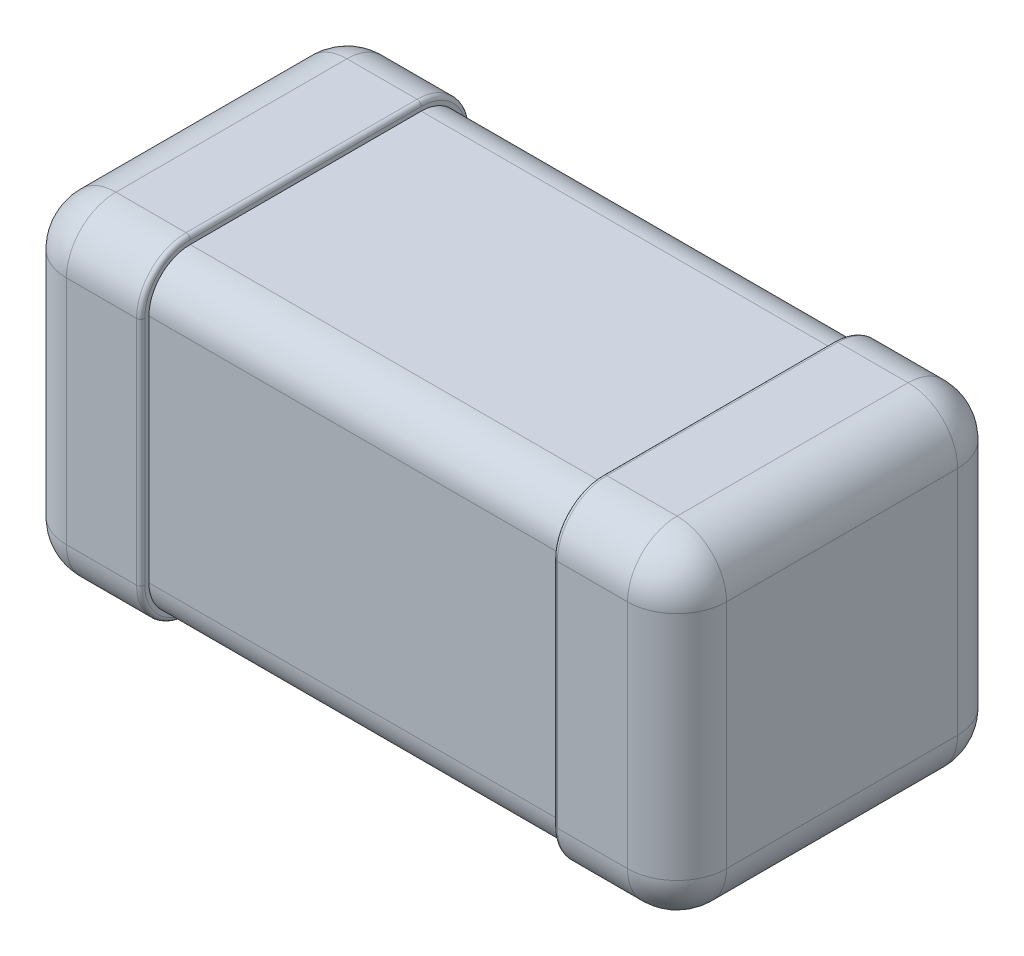
from build123d import *

# Parameters (mm, degrees)
SKETCH1_W               = 3.2
SKETCH1_H               = 1.6
BOSS_EXTRUDE1_DEPTH     = 0.8
CUT_EXTRUDE1_DEPTH      = 1
CUT_EXTRUDE1_DEPTH_BACK = 1
SKETCH3_OUTSIDE_W       = 4.384
SKETCH3_OUTSIDE_H       = 4.384
SKETCH3_OUTSIDE_W_2     = 1.52
SKETCH3_OUTSIDE_H_2     = 1.52
FILLET1_R               = 0.2
FILLET2_R               = 0.24
FILLET3_R               = 0.02


with BuildPart() as part:
    # Sketch1 → Boss-Extrude1 (new, symmetric)
    with BuildSketch(Plane(origin=(0, 0, 0), x_dir=(1, 0, 0), z_dir=(0, 1, 0))):
        Rectangle(SKETCH1_W, SKETCH1_H)
    extrude(amount=BOSS_EXTRUDE1_DEPTH, both=True)

    # Sketch3 outside → Cut-Extrude1 (cut, two sides: drawn at the far end of the back side and taken through both)
    with BuildSketch(Plane(origin=(0, 0, 0), x_dir=(0, 0, -1), z_dir=(1, 0, 0)).offset(-CUT_EXTRUDE1_DEPTH_BACK)):
        Rectangle(SKETCH3_OUTSIDE_W, SKETCH3_OUTSIDE_H)
        Rectangle(SKETCH3_OUTSIDE_W_2, SKETCH3_OUTSIDE_H_2, mode=Mode.SUBTRACT)
    extrude(amount=CUT_EXTRUDE1_DEPTH + CUT_EXTRUDE1_DEPTH_BACK, mode=Mode.SUBTRACT)

    # Fillet1
    fillet1_edges = [part.edges().sort_by_distance(p)[0] for p in [
        (0, -0.76, 0.76),
        (0, -0.76, -0.76),
        (0, 0.76, -0.76),
        (0, 0.76, 0.76),
    ]]
    fillet(fillet1_edges, radius=FILLET1_R)

    # Fillet2
    fillet2_edges = [part.edges().sort_by_distance(p)[0] for p in [
        (-1.6, 0.8, 0),
        (-1.3, 0.8, 0.8),
        (1.3, -0.8, 0.8),
        (-1.3, -0.8, -0.8),
        (-1.3, 0.8, -0.8),
        (1.3, 0.8, 0.8),
        (1.6, 0.8, 0),
        (-1.3, -0.8, 0.8),
        (-1.6, -0.8, 0),
        (1.3, -0.8, -0.8),
        (1.6, -0.8, 0),
        (1.3, 0.8, -0.8),
        (1.6, 0, 0.8),
        (-1.6, 0, 0.8),
        (-1.6, 0, -0.8),
        (1.6, 0, -0.8),
    ]]
    fillet(fillet2_edges, radius=FILLET2_R)

    # Fillet3
    fillet3_edges = [part.edges().sort_by_distance(p)[0] for p in [
        (1, 0, 0.8),
        (1, 0.8, 0),
        (1, 0, -0.8),
        (1, -0.8, 0),
        (-1, 0, -0.8),
        (-1, 0.8, 0),
        (-1, 0, 0.8),
        (-1, -0.8, 0),
        (-1, 0.729705627, -0.729705627),
        (-1, -0.729705627, -0.729705627),
        (-1, 0.729705627, 0.729705627),
        (-1, -0.729705627, 0.729705627),
        (1, -0.729705627, -0.729705627),
        (1, 0.729705627, -0.729705627),
        (1, -0.729705627, 0.729705627),
        (1, 0.729705627, 0.729705627),
    ]]
    fillet(fillet3_edges, radius=FILLET3_R)


solid = part.part
